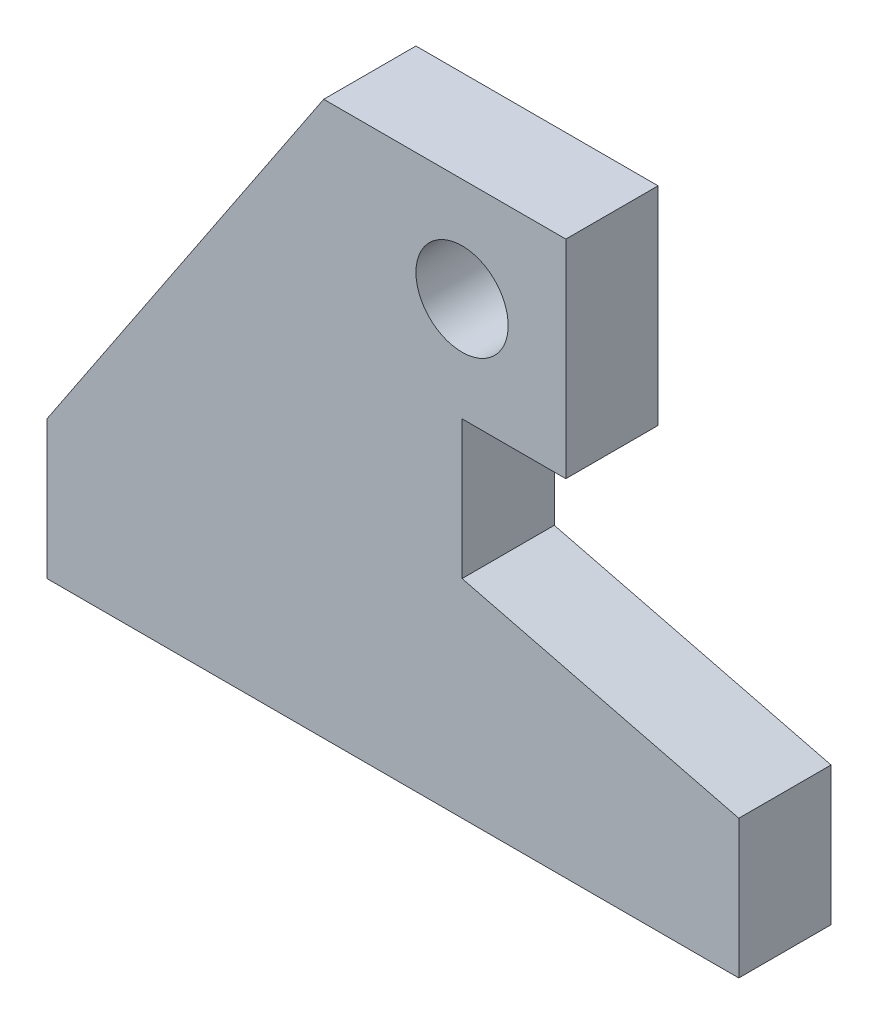
from build123d import *

# Parameters (mm, degrees)
SKETCH2_R      = 12.7
EXTRUDE1_DEPTH = 12.7


with BuildPart() as part:
    # Sketch2 → Extrude1 (new, symmetric)
    with BuildSketch(Plane.XY):
        Polygon((0, -28.575), (0, -66.675), (76.2, -85.725), (76.2, -123.825), (-114.3, -123.825), (-114.3, -85.725), (-38.1, 28.575), (28.575, 28.575), (28.575, -28.575), align=None)
        Circle(SKETCH2_R, mode=Mode.SUBTRACT)
    extrude(amount=EXTRUDE1_DEPTH, both=True)


solid = part.part
